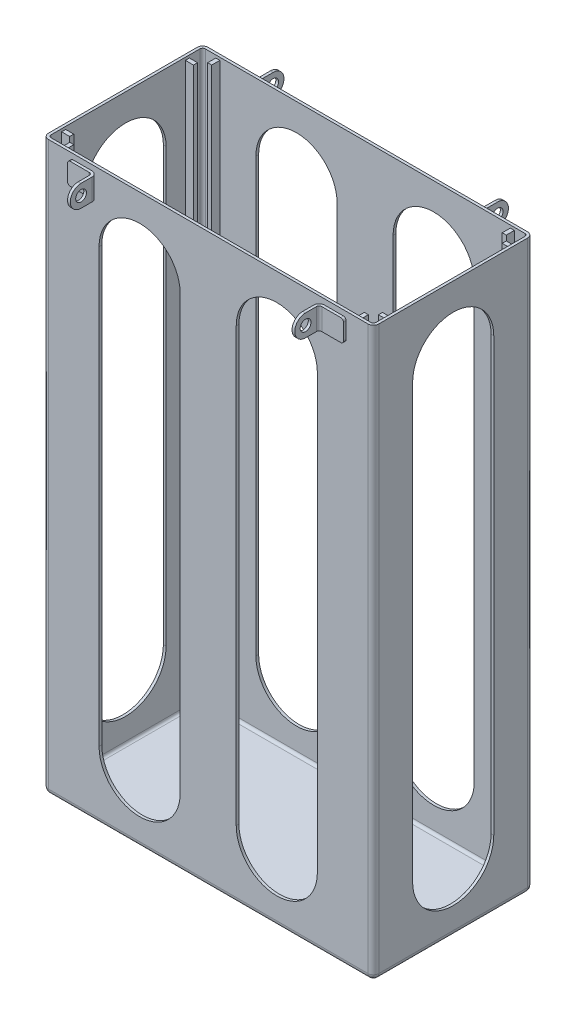
from build123d import *

# Parameters (mm, degrees)
SKETCH2_W             = 3
SKETCH2_H             = 6
BOSS_EXTRUDE1_DEPTH   = 208
SKETCH2_W_2           = 6
SKETCH2_H_2           = 3
BOSS_EXTRUDE1_2_DEPTH = 208
SKETCH3_W             = 244.3
SKETCH3_H             = 118
SKETCH3_W_2           = 240.3
SKETCH3_H_2           = 114
EXTRUDE_THIN1_DEPTH   = 210
SKETCH4_W             = 244.3
SKETCH4_H             = 118
BOSS_EXTRUDE2_DEPTH   = 2
CUT_EXTRUDE1_DEPTH    = 271.082621618
CUT_EXTRUDE2_DEPTH    = 328.511053249
EXTRUDE_THIN2_START   = -4
EXTRUDE_THIN2_DEPTH   = 16
FILLET1_RADIUS        = 8
FILLET1_LENGTH        = 2
SKETCH9_W             = 4
SKETCH9_H             = 40.15
FILLET2_R             = 2
FILLET3_R             = 4
FILLET4_R             = 2
FILLET5_R             = 4


with BuildPart() as part:
    # Sketch2 → Boss-Extrude1 (new, symmetric)
    with BuildSketch(Plane(origin=(0, 0, 0), x_dir=(1, 0, 0), z_dir=(0, 1, 0))):
        with Locations((-108.9, 54)):
            Rectangle(SKETCH2_W, SKETCH2_H)
    extrude(amount=BOSS_EXTRUDE1_DEPTH, both=True)


with BuildPart() as body_2:
    # Sketch2 → Boss-Extrude1 2 (new, symmetric)
    with BuildSketch(Plane(origin=(0, 0, 0), x_dir=(1, 0, 0), z_dir=(0, 1, 0))):
        with Locations((-117.15, 45.75)):
            Rectangle(SKETCH2_W_2, SKETCH2_H_2)
    extrude(amount=BOSS_EXTRUDE1_2_DEPTH, both=True)


with BuildPart() as body_3:
    # Mirror2: mirrored copy
    add(part.part.mirror(Plane.XY))


with BuildPart() as body_4:
    # Mirror2 2: mirrored copy
    add(body_2.part.mirror(Plane.XY))


with BuildPart() as body_5:
    # Mirror3: mirrored copy
    add(body_2.part.mirror(Plane(origin=(0, 0, 0), x_dir=(0, 0, 1), z_dir=(1, 0, 0))))


with BuildPart() as body_6:
    # Mirror3 2: mirrored copy
    add(body_3.part.mirror(Plane(origin=(0, 0, 0), x_dir=(0, 0, 1), z_dir=(1, 0, 0))))


with BuildPart() as body_7:
    # Mirror3 3: mirrored copy
    add(part.part.mirror(Plane(origin=(0, 0, 0), x_dir=(0, 0, 1), z_dir=(1, 0, 0))))


with BuildPart() as body_8:
    # Mirror3 4: mirrored copy
    add(body_4.part.mirror(Plane(origin=(0, 0, 0), x_dir=(0, 0, 1), z_dir=(1, 0, 0))))


with BuildPart() as body_9:
    # Sketch3 → Extrude-Thin1 (new, symmetric)
    with BuildSketch(Plane(origin=(0, 0, 0), x_dir=(1, 0, 0), z_dir=(0, 1, 0))):
        Rectangle(SKETCH3_W, SKETCH3_H)
        Rectangle(SKETCH3_W_2, SKETCH3_H_2, mode=Mode.SUBTRACT)
    extrude(amount=EXTRUDE_THIN1_DEPTH, both=True)

    # Sketch4 → Boss-Extrude2 (add)
    with BuildSketch(Plane.XZ.offset(208)):
        Rectangle(SKETCH4_W, SKETCH4_H)
    extrude(amount=BOSS_EXTRUDE2_DEPTH)

    # Sketch5 → Cut-Extrude1 (cut, through all)
    with BuildSketch(Plane.XY.offset(59)):
        with BuildLine():
            Line((-80.716666667, -160), (-80.716666667, 160))
            ThreePointArc((-80.716666667, 160), (-50.716666667, 190), (-20.716666667, 160))
            Line((-20.716666667, 160), (-20.716666667, -160))
            ThreePointArc((-20.716666667, -160), (-50.716666667, -190), (-80.716666667, -160))
        make_face()
        with BuildLine():
            Line((20.716666667, -160), (20.716666667, 160))
            ThreePointArc((20.716666667, 160), (50.716666667, 190), (80.716666667, 160))
            Line((80.716666667, 160), (80.716666667, -160))
            ThreePointArc((80.716666667, -160), (50.716666667, -190), (20.716666667, -160))
        make_face()
    extrude(amount=-CUT_EXTRUDE1_DEPTH, mode=Mode.SUBTRACT)

    # Sketch6 → Cut-Extrude2 (cut, through all)
    with BuildSketch(Plane(origin=(122.15, 0, 0), x_dir=(0, 0, -1), z_dir=(1, 0, 0))):
        with BuildLine():
            Line((-30, -160), (-30, 160))
            ThreePointArc((-30, 160), (0, 190), (30, 160))
            Line((30, 160), (30, -160))
            ThreePointArc((30, -160), (0, -190), (-30, -160))
        make_face()
    extrude(amount=-CUT_EXTRUDE2_DEPTH, mode=Mode.SUBTRACT)

    # Fillet4
    fillet4_edges = [body_9.edges().sort_by_distance(p)[0] for p in [
        (-120.15, 1, -57),
        (-120.15, 1, 57),
        (120.15, 1, 57),
        (120.15, 1, -57),
        (0, -208, -57),
        (0, -208, 57),
        (-120.15, -208, 0),
        (120.15, -208, 0),
    ]]
    fillet(fillet4_edges, radius=FILLET4_R)

    # Fillet5
    fillet5_edges = [body_9.edges().sort_by_distance(p)[0] for p in [
        (0, -210, -59),
        (122.15, -210, 0),
        (0, -210, 59),
        (-122.15, -210, 0),
        (-122.15, 0, -59),
        (122.15, 0, -59),
        (122.15, 0, 59),
        (-122.15, 0, 59),
    ]]
    fillet(fillet5_edges, radius=FILLET5_R)


with BuildPart() as body_10:
    # Sketch7 → Extrude-Thin2 (new body)
    with BuildSketch(Plane(origin=(0, 210, 0), x_dir=(1, 0, 0), z_dir=(0, 1, 0)).offset(EXTRUDE_THIN2_START)):
        Polygon((-102, 59), (-82, 59), (-82, 79), (-84, 79), (-84, 61), (-102, 61), align=None)
    extrude(amount=-EXTRUDE_THIN2_DEPTH)

    # Fillet1: full round fillet: the end face becomes a half cylinder, R = half its width
    fillet1_face = Plane((-83, 198, -79), x_dir=(1, 0, 0), z_dir=(0, 0, -1))  # on the end face: x along it, z out of the body
    fillet1_slab = fillet1_face.offset(-FILLET1_RADIUS / 2) * Box(FILLET1_LENGTH, 2 * FILLET1_RADIUS, FILLET1_RADIUS, mode=Mode.PRIVATE)  # the body's end, R deep
    fillet1_round = Plane((-83, 198, -71), x_dir=(0, 0, -1), z_dir=(1, 0, 0)) * Cylinder(FILLET1_RADIUS, FILLET1_LENGTH, mode=Mode.PRIVATE)  # its axis R under the face
    add(fillet1_slab - fillet1_round, mode=Mode.SUBTRACT)

    # Sketch9 → Ø8.0mm Dowel Hole1 (revolve, cut)
    with BuildSketch(Plane(origin=(-82, 198, -71), x_dir=(0, 0, -1), z_dir=(0, 1, 0))):
        with Locations((2, 20.075)):
            Rectangle(SKETCH9_W, SKETCH9_H)
    revolve(axis=Axis((-75.65, 198, -71), (-1, 0, 0)), mode=Mode.SUBTRACT)

    # Fillet2
    fillet2_edges = [body_10.edges().sort_by_distance(p)[0] for p in [
        (-102, 190, -60),
        (-102, 206, -60),
        (-84, 198, -61),
    ]]
    fillet(fillet2_edges, radius=FILLET2_R)

    # Fillet3
    fillet3_edges = [body_10.edges().sort_by_distance(p)[0] for p in [
        (-82, 198, -59),
    ]]
    fillet(fillet3_edges, radius=FILLET3_R)


with BuildPart() as body_11:
    # Mirror4: mirrored copy
    add(body_10.part.mirror(Plane(origin=(0, 0, 0), x_dir=(0, 0, 1), z_dir=(1, 0, 0))))


with BuildPart() as body_12:
    # Mirror5: mirrored copy
    add(body_11.part.mirror(Plane.XY))


with BuildPart() as body_13:
    # Mirror5 2: mirrored copy
    add(body_10.part.mirror(Plane.XY))


solid = Compound([part.part, body_2.part, body_3.part, body_4.part, body_5.part, body_6.part, body_7.part, body_8.part, body_9.part, body_10.part, body_11.part, body_12.part, body_13.part])
